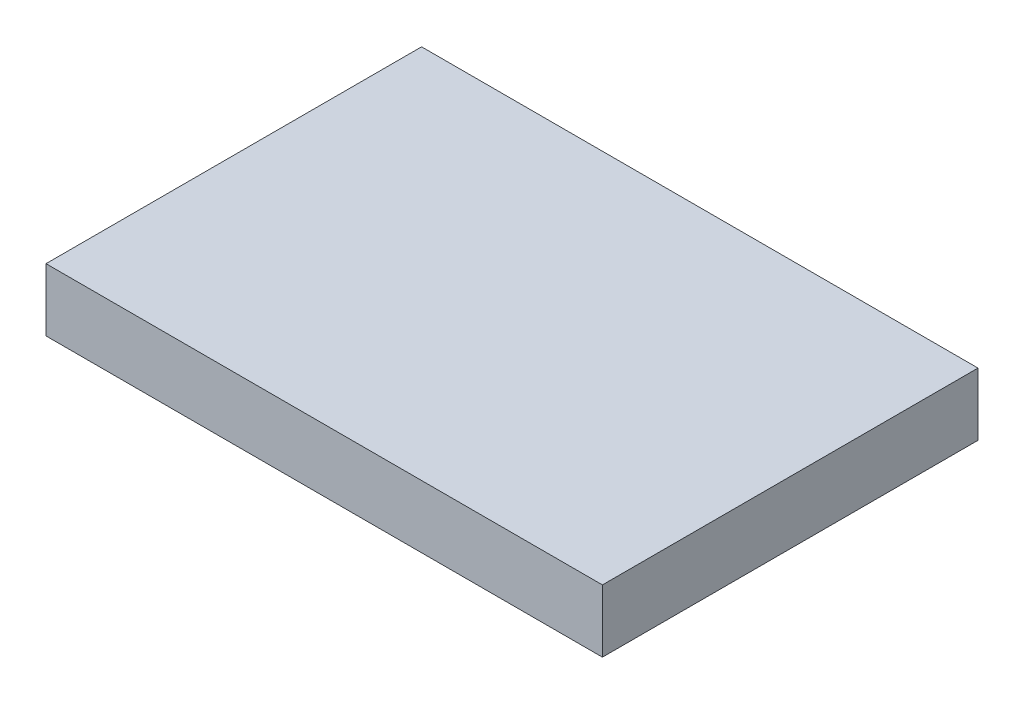
from build123d import *

# Parameters (mm, degrees)
SKETCH1_W           = 13.75
SKETCH1_H           = 40
SKETCH1_W_2         = 13.25
BOSS_EXTRUDE1_DEPTH = 9


with BuildPart() as part:
    # Sketch1 → Boss-Extrude1 (new body)
    with BuildSketch(Plane(origin=(2.725879216, 0, 0), x_dir=(0, 0, -1), z_dir=(0, -1, 0))):
        with Locations((-20.125, 17.274120784)):
            Rectangle(SKETCH1_W, SKETCH1_H)
        with Locations((-20.125, -22.725879216)):
            Rectangle(SKETCH1_W, SKETCH1_H)
        with Locations((-6.375, 17.274120784)):
            Rectangle(SKETCH1_W, SKETCH1_H)
        with Locations((-6.375, -22.725879216)):
            Rectangle(SKETCH1_W, SKETCH1_H)
        with Locations((7.125, 17.274120784)):
            Rectangle(SKETCH1_W_2, SKETCH1_H)
        with Locations((7.125, -22.725879216)):
            Rectangle(SKETCH1_W_2, SKETCH1_H)
        with Locations((20.375, 17.274120784)):
            Rectangle(SKETCH1_W_2, SKETCH1_H)
        with Locations((20.375, -22.725879216)):
            Rectangle(SKETCH1_W_2, SKETCH1_H)
    extrude(amount=BOSS_EXTRUDE1_DEPTH)


solid = part.part
